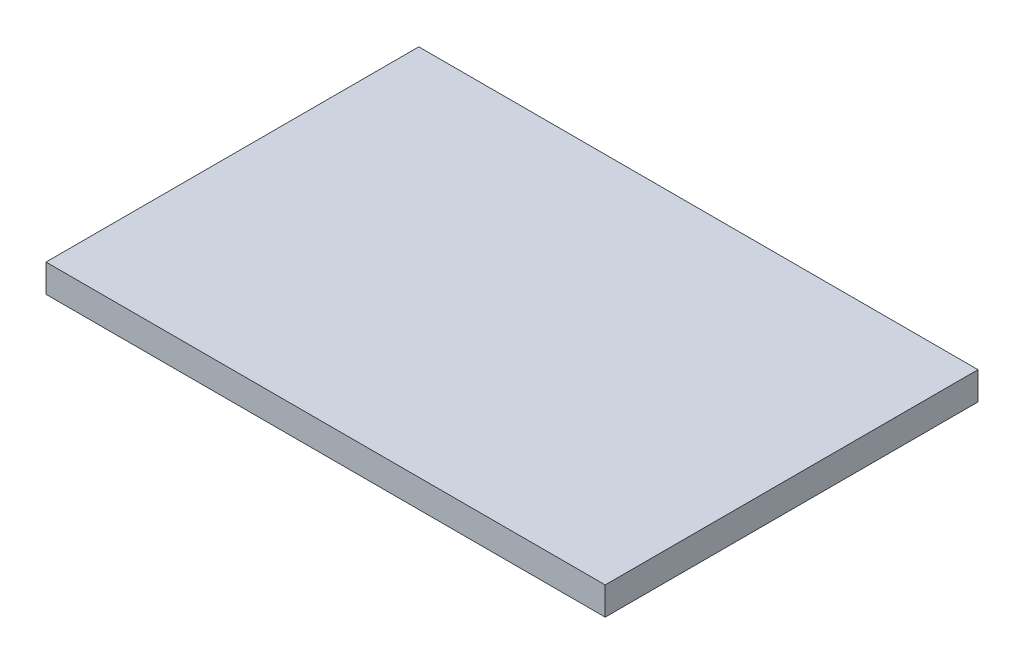
from build123d import *

# Parameters (mm, degrees)
ESQUISSE1_W        = 60
ESQUISSE1_H        = 40
BOSS_EXTRU_1_DEPTH = 3


with BuildPart() as part:
    # Esquisse1 → Boss.-Extru.1 (new body)
    with BuildSketch(Plane(origin=(0, 0, 0), x_dir=(1, 0, 0), z_dir=(0, 1, 0))):
        Rectangle(ESQUISSE1_W, ESQUISSE1_H)
    extrude(amount=BOSS_EXTRU_1_DEPTH)


solid = part.part
